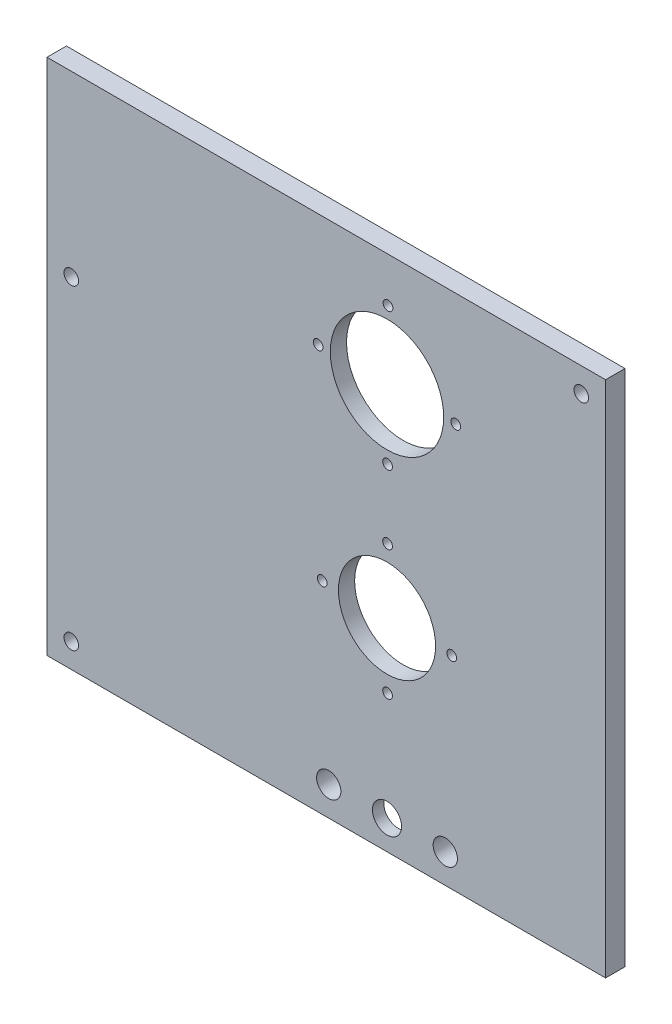
from build123d import *

# Parameters (mm, degrees)
ESQUISSE1_W             = 345
ESQUISSE1_H             = 320
ESQUISSE1_R             = 4.5
ESQUISSE1_R_2           = 30
ESQUISSE1_R_3           = 35
BASE_EXTRUSION_DEPTH    = 12
ESQUISSE2_R             = 55
ESQUISSE2_R_2           = 47.5
ENL_V_MAT_EXTRU_1_DEPTH = 2
PER_AGE3_D              = 6
ESQUISSE8_R             = 9
ESQUISSE8_R_2           = 7.5
ENL_V_MAT_EXTRU_2_DEPTH = 348.230471013
ENL_V_MAT_EXTRU_3_DEPTH = 5


with BuildPart() as part:
    # Esquisse1 → Base-Extrusion (new body)
    with BuildSketch(Plane.XY):
        with Locations((32.5, -120)):
            Rectangle(ESQUISSE1_W, ESQUISSE1_H)
        with Locations((190, 25)):
            Circle(ESQUISSE1_R, mode=Mode.SUBTRACT)
        with Locations((-125, -265)):
            Circle(ESQUISSE1_R, mode=Mode.SUBTRACT)
        with Locations(Location((70, -155, 0), (0, 0, 180))):
            Circle(ESQUISSE1_R_2, mode=Mode.SUBTRACT)
        with Locations(Location((70, -30, 0), (0, 0, 180))):
            Circle(ESQUISSE1_R_3, mode=Mode.SUBTRACT)
        with Locations((-125, -70)):
            Circle(ESQUISSE1_R, mode=Mode.SUBTRACT)
    extrude(amount=BASE_EXTRUSION_DEPTH)

    # Esquisse2 → Enlèv. mat.-Extru.1 (cut)
    with BuildSketch(Plane(origin=(0, 0, 0), x_dir=(-1, 0, 0), z_dir=(0, 0, -1))):
        with Locations((-70, -30)):
            Circle(ESQUISSE2_R)
        with Locations((-70, -155)):
            Circle(ESQUISSE2_R_2)
    extrude(amount=-ENL_V_MAT_EXTRU_1_DEPTH, mode=Mode.SUBTRACT)

    # Perçage3 (through all)
    with Locations(Plane.XY.offset(12)):
        with Locations((70.60973448, 12.5), (70.358898569, -72.5), (112.5, -30), (27.5, -30), (110, -155), (70.358898569, -195), (30, -155), (70.358898569, -115)):
            Hole(PER_AGE3_D / 2)

    # Esquisse8 → Enlèv. mat.-Extru.2 (cut, through all)
    with BuildSketch(Plane.XY.offset(12)):
        with Locations((70, -262)):
            Circle(ESQUISSE8_R)
        with Locations((34, -262)):
            Circle(ESQUISSE8_R_2)
        with Locations((106, -262)):
            Circle(ESQUISSE8_R_2)
    extrude(amount=-ENL_V_MAT_EXTRU_2_DEPTH, mode=Mode.SUBTRACT)

    # Esquisse9 → Enlèv. mat.-Extru.3 (cut)
    with BuildSketch(Plane(origin=(0, 0, 0), x_dir=(-1, 0, 0), z_dir=(0, 0, -1))):
        with BuildLine():
            Line((-52, -262), (-52, -280))
            Line((-52, -280), (-88, -280))
            Line((-88, -280), (-88, -262))
            ThreePointArc((-88, -262), (-70, -244), (-52, -262))
        make_face()
    extrude(amount=-ENL_V_MAT_EXTRU_3_DEPTH, mode=Mode.SUBTRACT)


solid = part.part
